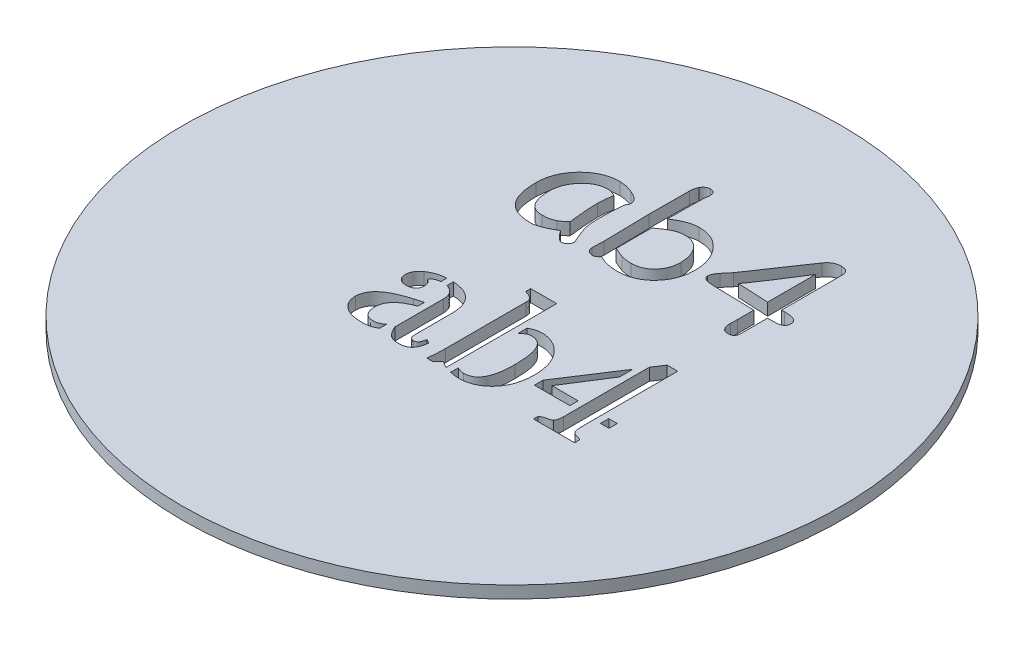
from build123d import *

# Parameters (mm, degrees)
SKETCH_2_R          = 18.845643173
EXTRUDE_2_DEPTH     = 0.7
SKETCH_1_W          = 0.487239366
SKETCH_1_H          = 0.472675146
CUT_EXTRUDE_1_DEPTH = 2.4


with BuildPart() as part:
    # Эскиз2 → Бобышка-Вытянуть2 (new body)
    with BuildSketch(Plane(origin=(0, 0, 0), x_dir=(1, 0, 0), z_dir=(0, 1, 0))):
        with Locations(Location((0, 0, 0), (0, 0, 270))):
            Circle(SKETCH_2_R)
    extrude(amount=EXTRUDE_2_DEPTH)

    # Эскиз1 → Вырез-Вытянуть1 (cut)
    # profile 1 of 11: a face of its own
    with BuildSketch(Plane(origin=(0, 0, 0), x_dir=(1, 0, 0), z_dir=(0, 1, 0))):
        with BuildLine():
            add(Edge.make_bspline(
                [(-2.260520196, 5.058187775), (-2.2769834, 5.061911652), (-2.317694537, 5.071120265), (-2.38128443, 5.115981547), (-2.462033272, 5.180543609), (-2.518968863, 5.235747272), (-2.550735039, 5.26654715)],
                knots=[0, 0, 0, 0, 0.555695463, 1.374155035, 2.534957635, 4, 4, 4, 4], degree=3))
            add(Edge.make_bspline(
                [(-2.550735039, 5.26654715), (-2.580452597, 5.297641936), (-2.63753641, 5.357371239), (-2.71309272, 5.447573671), (-2.779753485, 5.530558927), (-2.815371137, 5.587025085), (-2.832268243, 5.613812775)],
                knots=[0, 0, 0, 0, 1.151952229, 2.212760143, 3.152128841, 4, 4, 4, 4], degree=3))
            add(Edge.make_bspline(
                [(-2.832268243, 5.613812775), (-2.897392594, 5.576671649), (-3.022597015, 5.505266208), (-3.206172179, 5.407899619), (-3.378313795, 5.32595224), (-3.537984437, 5.258647147), (-3.685362526, 5.205873206), (-3.819663789, 5.16676142), (-3.942244109, 5.142668332), (-4.019910404, 5.139194129), (-4.056379571, 5.137562775)],
                knots=[0, 0, 0, 0, 1.357382431, 2.60962722, 3.761399541, 4.808177135, 5.745711274, 6.593953003, 7.339773276, 8, 8, 8, 8], degree=3))
            add(Edge.make_bspline(
                [(-4.056379571, 5.137562775), (-4.135834498, 5.139093758), (-4.289412381, 5.142052984), (-4.511442044, 5.168570092), (-4.71690321, 5.211009732), (-4.905406334, 5.272357285), (-5.078754949, 5.348637104), (-5.233911449, 5.44512655), (-5.374936563, 5.556536526), (-5.452528568, 5.645978969), (-5.491330743, 5.690707306)],
                knots=[0, 0, 0, 0, 1.198237041, 2.31606415, 3.368011987, 4.358092637, 5.301625415, 6.21724908, 7.108482723, 8, 8, 8, 8], degree=3))
            add(Edge.make_bspline(
                [(-5.491330743, 5.690707306), (-5.525473432, 5.736293186), (-5.59515498, 5.829329052), (-5.681925968, 5.986472474), (-5.754900475, 6.160836939), (-5.813541173, 6.352621419), (-5.861111625, 6.561018444), (-5.893562508, 6.786643726), (-5.913819922, 7.0297861), (-5.91573803, 7.197548974), (-5.916731133, 7.284408478)],
                knots=[0, 0, 0, 0, 0.812552431, 1.658331892, 2.555229492, 3.507519434, 4.518618694, 5.604829532, 6.759896565, 8, 8, 8, 8], degree=3))
            add(Edge.make_bspline(
                [(-5.916731133, 7.284408478), (-5.914555553, 7.367608581), (-5.910274223, 7.531338311), (-5.877309546, 7.772306463), (-5.822856007, 8.004186689), (-5.745639848, 8.226814289), (-5.64683069, 8.44013116), (-5.52760746, 8.644631929), (-5.384806451, 8.838941462), (-5.222605566, 9.021731492), (-5.045226105, 9.18921156), (-4.858255177, 9.337558907), (-4.661813035, 9.46290541), (-4.456937145, 9.565066529), (-4.242843142, 9.643273979), (-4.021658328, 9.700843941), (-3.791214553, 9.735113399), (-3.634815026, 9.739223708), (-3.555324883, 9.741312775)],
                knots=[0, 0, 0, 0, 1.054731984, 2.075610185, 3.077564362, 4.070606348, 5.058056501, 6.05423441, 7.067099876, 8.110607853, 9.148928189, 10.156761868, 11.132552149, 12.098435385, 13.053748134, 14.01750944, 14.992398115, 16, 16, 16, 16], degree=3))
            add(Edge.make_bspline(
                [(-3.555324883, 9.741312775), (-3.492767069, 9.738531688), (-3.362655322, 9.732747406), (-3.162601387, 9.696374588), (-2.951844983, 9.63628086), (-2.811148237, 9.580535036), (-2.73801043, 9.551556915)],
                knots=[0, 0, 0, 0, 0.889365109, 1.849758484, 2.882248842, 4, 4, 4, 4], degree=3))
            add(Edge.make_bspline(
                [(-2.73801043, 9.551556915), (-2.693036079, 9.531990423), (-2.607839021, 9.494924683), (-2.491356397, 9.431468635), (-2.392932382, 9.364987839), (-2.311843266, 9.295192884), (-2.248762418, 9.221641065), (-2.203174422, 9.145052257), (-2.173360661, 9.065038691), (-2.170279339, 9.009822587), (-2.168742852, 8.982289337)],
                knots=[0, 0, 0, 0, 1.381705711, 2.617431031, 3.732296057, 4.723070722, 5.624086893, 6.449303074, 7.226752293, 8, 8, 8, 8], degree=3))
            add(Edge.make_bspline(
                [(-2.168742852, 8.982289337), (-2.169519783, 8.963537197), (-2.171052809, 8.926535797), (-2.188792864, 8.87339803), (-2.214388652, 8.822515635), (-2.239956495, 8.793686831), (-2.253078789, 8.7788909)],
                knots=[0, 0, 0, 0, 0.993157303, 1.959680908, 2.952838212, 4, 4, 4, 4], degree=3))
            add(Edge.make_bspline(
                [(-2.253078789, 8.7788909), (-2.260226354, 8.747978757), (-2.276403127, 8.678016649), (-2.289760674, 8.558594543), (-2.307544634, 8.414202695), (-2.318501424, 8.243607426), (-2.328132305, 8.047208046), (-2.33745014, 7.825222109), (-2.341380834, 7.577111571), (-2.343659848, 7.403057175), (-2.344856133, 7.311693634)],
                knots=[0, 0, 0, 0, 0.516827984, 1.169714305, 1.956377237, 2.888851328, 3.955038626, 5.162311074, 6.510458132, 8, 8, 8, 8], degree=3))
            add(Edge.make_bspline(
                [(-2.344856133, 7.311693634), (-2.344444692, 7.228984378), (-2.343666411, 7.072531754), (-2.329998424, 6.851915847), (-2.308343632, 6.658049706), (-2.282503357, 6.539699031), (-2.270442071, 6.484457306)],
                knots=[0, 0, 0, 0, 1.19200198, 2.25478799, 3.185399486, 4, 4, 4, 4], degree=3))
            add(Edge.make_bspline(
                [(-2.270442071, 6.484457306), (-2.266037417, 6.467054616), (-2.256113236, 6.427844393), (-2.236033221, 6.363771154), (-2.209584819, 6.288386677), (-2.178886445, 6.201297545), (-2.141131588, 6.103096879), (-2.098087023, 5.992978082), (-2.047863656, 5.871433811), (-2.013253099, 5.786224265), (-1.995110039, 5.741556915)],
                knots=[0, 0, 0, 0, 0.543324072, 1.224170439, 2.031506418, 2.961691587, 4.019197454, 5.215989979, 6.540605439, 8, 8, 8, 8], degree=3))
            add(Edge.make_bspline(
                [(-1.995110039, 5.741556915), (-1.989379118, 5.727477369), (-1.976669194, 5.696252033), (-1.954127221, 5.644878129), (-1.925387631, 5.584999381), (-1.905335673, 5.541495579), (-1.894651055, 5.518314728)],
                knots=[0, 0, 0, 0, 0.745010443, 1.652269271, 2.749019729, 4, 4, 4, 4], degree=3))
            Line((-1.894651055, 5.518314728), (-1.868606133, 5.446381134))
            add(Edge.make_bspline(
                [(-1.868606133, 5.446381134), (-1.869877153, 5.419311434), (-1.872349258, 5.366661472), (-1.896367224, 5.291924253), (-1.931850588, 5.223024589), (-1.984780386, 5.1660371), (-2.045516976, 5.118577456), (-2.112546232, 5.083281401), (-2.185360376, 5.062867898), (-2.23517871, 5.059765762), (-2.260520196, 5.058187775)],
                knots=[0, 0, 0, 0, 1.055781092, 2.053470688, 3.044847395, 4.064324308, 5.067244292, 6.051071831, 7.008623294, 8, 8, 8, 8], degree=3))
        make_face()
        with BuildLine():
            add(Edge.make_bspline(
                [(-3.138606133, 8.01366629), (-3.137079223, 8.077352893), (-3.133892373, 8.210274694), (-3.117892834, 8.417411489), (-3.087056016, 8.638937336), (-3.060523936, 8.790958679), (-3.046828789, 8.869428009)],
                knots=[0, 0, 0, 0, 0.88697149, 1.851218968, 2.890857011, 4, 4, 4, 4], degree=3))
            add(Edge.make_bspline(
                [(-3.046828789, 8.869428009), (-3.094788833, 8.893929969), (-3.182303167, 8.938639534), (-3.306753349, 8.986659558), (-3.409085811, 9.018725024), (-3.471250717, 9.024449373), (-3.498274102, 9.026937775)],
                knots=[0, 0, 0, 0, 1.341238509, 2.447403828, 3.325078951, 4, 4, 4, 4], degree=3))
            add(Edge.make_bspline(
                [(-3.498274102, 9.026937775), (-3.552517448, 9.025181712), (-3.659920104, 9.021704683), (-3.81817738, 8.996625113), (-3.970180327, 8.953923918), (-4.117255423, 8.895687123), (-4.256965395, 8.817304912), (-4.39338599, 8.725748328), (-4.52270929, 8.615536189), (-4.64398566, 8.489852973), (-4.755073329, 8.353890526), (-4.854786096, 8.212244733), (-4.936019863, 8.063434336), (-5.005504674, 7.911021167), (-5.05689261, 7.752191637), (-5.096331373, 7.589045328), (-5.118626605, 7.420214134), (-5.121522834, 7.305967013), (-5.122981133, 7.248441681)],
                knots=[0, 0, 0, 0, 0.976615751, 1.933714126, 2.876548638, 3.815200477, 4.774727746, 5.755505532, 6.769702424, 7.827890142, 8.896423243, 9.928951538, 10.941972897, 11.945015674, 12.940821975, 13.942980332, 14.964256267, 16, 16, 16, 16], degree=3))
            add(Edge.make_bspline(
                [(-5.122981133, 7.248441681), (-5.122472015, 7.19218474), (-5.121482384, 7.082831669), (-5.107997337, 6.924419771), (-5.090771625, 6.77628437), (-5.063005484, 6.639673132), (-5.029240927, 6.51352803), (-4.984832545, 6.399229256), (-4.936287314, 6.29394598), (-4.877419979, 6.200646145), (-4.811598197, 6.117463388), (-4.736677434, 6.046866861), (-4.654815666, 5.986224371), (-4.565510255, 5.936196204), (-4.467025718, 5.899107951), (-4.361741994, 5.872471593), (-4.248854864, 5.853796331), (-4.170975167, 5.852570325), (-4.130793633, 5.851937775)],
                knots=[0, 0, 0, 0, 1.385053073, 2.692286587, 3.913500936, 5.055672189, 6.122813422, 7.125029461, 8.072314099, 8.973498475, 9.835345066, 10.677972226, 11.50067925, 12.339298428, 13.190189537, 14.084155314, 15.011532147, 16, 16, 16, 16], degree=3))
            add(Edge.make_bspline(
                [(-4.130793633, 5.851937775), (-4.064964358, 5.853935778), (-3.937673992, 5.857799206), (-3.754368025, 5.884741756), (-3.586061419, 5.931124967), (-3.483705531, 5.977934678), (-3.433781914, 6.0007659)],
                knots=[0, 0, 0, 0, 1.098427608, 2.12396769, 3.084973818, 4, 4, 4, 4], degree=3))
            add(Edge.make_bspline(
                [(-3.433781914, 6.0007659), (-3.405423027, 6.017327674), (-3.341690387, 6.054547949), (-3.24221643, 6.126014603), (-3.127528572, 6.217482365), (-3.047783865, 6.286918519), (-3.004660821, 6.324467071)],
                knots=[0, 0, 0, 0, 0.731520458, 1.643990121, 2.725955338, 4, 4, 4, 4], degree=3))
            add(Edge.make_bspline(
                [(-3.004660821, 6.324467071), (-3.015136149, 6.415402192), (-3.035412891, 6.591422255), (-3.062534885, 6.846932566), (-3.086646712, 7.084567464), (-3.104844893, 7.304587239), (-3.120446655, 7.506689739), (-3.129995221, 7.691557663), (-3.136697687, 7.858589784), (-3.137995551, 7.964051573), (-3.138606133, 8.01366629)],
                knots=[0, 0, 0, 0, 1.29584854, 2.508330538, 3.637509546, 4.677124825, 5.633672839, 6.506959432, 7.297595963, 8, 8, 8, 8], degree=3))
        make_face(mode=Mode.SUBTRACT)
    # profile 2 of 11: a face of its own
    with BuildSketch(Plane(origin=(0, 0, 0), x_dir=(1, 0, 0), z_dir=(0, 1, 0))):
        with BuildLine():
            add(Edge.make_bspline(
                [(0.799138007, 5.216937775), (0.745788762, 5.218094442), (0.640192209, 5.220383887), (0.483137404, 5.232502515), (0.329896627, 5.254814063), (0.180641081, 5.286410045), (0.034765936, 5.32402418), (-0.106872526, 5.373423513), (-0.245766484, 5.429374785), (-0.334740446, 5.474660538), (-0.379084649, 5.497230743)],
                knots=[0, 0, 0, 0, 1.04690103, 2.072178137, 3.08856036, 4.082853573, 5.064660397, 6.042000395, 7.02414225, 8, 8, 8, 8], degree=3))
            add(Edge.make_bspline(
                [(-0.379084649, 5.497230743), (-0.401702198, 5.466576155), (-0.444356024, 5.408765495), (-0.526535544, 5.345637172), (-0.614939176, 5.302653836), (-0.678324264, 5.298435797), (-0.710227227, 5.296312775)],
                knots=[0, 0, 0, 0, 1.127682817, 2.126666575, 3.057114412, 4, 4, 4, 4], degree=3))
            add(Edge.make_bspline(
                [(-0.710227227, 5.296312775), (-0.736398287, 5.29783683), (-0.787052314, 5.300786635), (-0.860383432, 5.321188606), (-0.926792058, 5.356761019), (-0.985796275, 5.40471261), (-1.034654027, 5.463114649), (-1.069967938, 5.530301483), (-1.09166733, 5.604642696), (-1.094494259, 5.656660788), (-1.095940118, 5.6832659)],
                knots=[0, 0, 0, 0, 1.031178717, 1.995844095, 2.972544323, 3.980284098, 4.975430773, 5.952131002, 6.952599355, 8, 8, 8, 8], degree=3))
            add(Edge.make_bspline(
                [(-1.095940118, 5.6832659), (-1.095474598, 5.703521648), (-1.094448592, 5.748165396), (-1.094011459, 5.821387303), (-1.089083342, 5.907310312), (-1.08648895, 6.002044808), (-1.081172409, 6.097073637), (-1.076913016, 6.18345753), (-1.076324216, 6.257086093), (-1.075314336, 6.301730538), (-1.074856133, 6.321986603)],
                knots=[0, 0, 0, 0, 0.760846403, 1.676908415, 2.749093299, 3.991905837, 5.2353969, 6.323091585, 7.239153597, 8, 8, 8, 8], degree=3))
            add(Edge.make_bspline(
                [(-1.074856133, 6.321986603), (-1.074783469, 6.360847454), (-1.074628861, 6.443532066), (-1.075943917, 6.574176016), (-1.078735046, 6.718445651), (-1.081305483, 6.876366845), (-1.082952053, 7.047966295), (-1.088921514, 7.233548986), (-1.093548064, 7.432407501), (-1.098445492, 7.640768565), (-1.10324356, 7.848718606), (-1.107968893, 8.047988061), (-1.113868891, 8.233572581), (-1.115539515, 8.405584778), (-1.118105233, 8.563506093), (-1.120897464, 8.7077757), (-1.122212268, 8.838419657), (-1.12205769, 8.921104268), (-1.121985039, 8.959965118)],
                knots=[0, 0, 0, 0, 0.706964872, 1.504216054, 2.376770452, 3.332043551, 4.377557263, 5.498575529, 6.709814547, 7.996240749, 9.290185809, 10.493906259, 11.622442737, 12.667956449, 13.623229548, 14.495783946, 15.293035128, 16, 16, 16, 16], degree=3))
            add(Edge.make_bspline(
                [(-1.121985039, 8.959965118), (-1.121990167, 8.988077121), (-1.122001479, 9.050088891), (-1.121897689, 9.151374227), (-1.122392701, 9.269614047), (-1.120124517, 9.404791195), (-1.121331531, 9.556935081), (-1.118863381, 9.726012672), (-1.120018983, 9.911641275), (-1.118055206, 10.108834817), (-1.117294992, 10.306033984), (-1.11527189, 10.492064736), (-1.11642486, 10.661570945), (-1.113962585, 10.814111308), (-1.115163074, 10.950133149), (-1.112907867, 11.068772777), (-1.113378762, 11.170889986), (-1.113327035, 11.233314849), (-1.113303399, 11.261840118)],
                knots=[0, 0, 0, 0, 0.586198384, 1.29308467, 2.112038294, 3.051719364, 4.112048793, 5.284477253, 6.577561923, 7.982740374, 9.396539228, 10.689652632, 11.8620494, 12.931034153, 13.87067568, 14.698294766, 15.405181052, 16, 16, 16, 16], degree=3))
            add(Edge.make_bspline(
                [(-1.113303399, 11.261840118), (-1.112452074, 11.3024839), (-1.11078054, 11.382285969), (-1.087556008, 11.497884364), (-1.057306318, 11.609026826), (-1.023501676, 11.676937695), (-1.006643243, 11.710804962)],
                knots=[0, 0, 0, 0, 1.044703072, 2.051223175, 3.028141653, 4, 4, 4, 4], degree=3))
            add(Edge.make_bspline(
                [(-1.006643243, 11.710804962), (-0.982880585, 11.749109396), (-0.937684067, 11.821964337), (-0.843232171, 11.903404516), (-0.734858201, 11.955292487), (-0.657063154, 11.960926523), (-0.617209649, 11.963812775)],
                knots=[0, 0, 0, 0, 1.102656239, 2.097249514, 3.025242864, 4, 4, 4, 4], degree=3))
            add(Edge.make_bspline(
                [(-0.617209649, 11.963812775), (-0.592309314, 11.962621117), (-0.544737835, 11.960344485), (-0.478132387, 11.943362413), (-0.421540274, 11.913781737), (-0.373832883, 11.87360757), (-0.339033287, 11.819290273), (-0.314342629, 11.754730776), (-0.299538404, 11.67880017), (-0.298033033, 11.624473218), (-0.29722918, 11.595463165)],
                knots=[0, 0, 0, 0, 1.069996723, 2.044202454, 2.926544356, 3.795904631, 4.692978392, 5.666535517, 6.753953128, 8, 8, 8, 8], degree=3))
            add(Edge.make_bspline(
                [(-0.29722918, 11.595463165), (-0.298417773, 11.571018918), (-0.301255259, 11.512663999), (-0.318313164, 11.421830353), (-0.33537107, 11.330996706), (-0.338208556, 11.272641788), (-0.339397149, 11.24819754)],
                knots=[0, 0, 0, 0, 0.837778476, 2, 3.162221524, 4, 4, 4, 4], degree=3))
            Line((-0.339397149, 11.24819754), (-0.351799493, 10.321742462))
            Line((-0.351799493, 10.321742462), (-0.360481133, 9.247699493))
            add(Edge.make_bspline(
                [(-0.360481133, 9.247699493), (-0.300081814, 9.286747146), (-0.182616917, 9.362687215), (-0.005267208, 9.463434882), (0.167574731, 9.548074462), (0.335554638, 9.618171914), (0.499076974, 9.673460978), (0.658512668, 9.711658092), (0.812788949, 9.737095387), (0.914386221, 9.739927339), (0.964089179, 9.741312775)],
                knots=[0, 0, 0, 0, 1.204180757, 2.341896757, 3.41311755, 4.424888868, 5.388106114, 6.299820328, 7.168245785, 8, 8, 8, 8], degree=3))
            add(Edge.make_bspline(
                [(0.964089179, 9.741312775), (1.038196633, 9.739049392), (1.183352693, 9.73461605), (1.395996772, 9.703284127), (1.598080017, 9.650314493), (1.788577742, 9.573645287), (1.969352719, 9.477741687), (2.138263898, 9.358882399), (2.297445033, 9.219309411), (2.391896713, 9.112370439), (2.439968086, 9.057943634)],
                knots=[0, 0, 0, 0, 1.056289991, 2.068980708, 3.056807806, 4.027556406, 4.98994988, 5.967668714, 6.965640913, 8, 8, 8, 8], degree=3))
            add(Edge.make_bspline(
                [(2.439968086, 9.057943634), (2.482897108, 9.003797534), (2.568415176, 8.895934143), (2.675531351, 8.719490095), (2.767876081, 8.535418442), (2.844151272, 8.342208035), (2.902334749, 8.13947672), (2.942823846, 7.927321519), (2.968226296, 7.70629098), (2.971569615, 7.555675856), (2.973268867, 7.479125275)],
                knots=[0, 0, 0, 0, 0.973927232, 1.940141456, 2.905122926, 3.876532643, 4.865843001, 5.875754331, 6.920345875, 8, 8, 8, 8], degree=3))
            add(Edge.make_bspline(
                [(2.973268867, 7.479125275), (2.971269969, 7.401740259), (2.967333126, 7.249329987), (2.93899115, 7.025235954), (2.888684523, 6.810787963), (2.820253118, 6.605269463), (2.733562869, 6.407637322), (2.624408035, 6.220316115), (2.497907981, 6.040617255), (2.351997446, 5.873693244), (2.193283229, 5.720149774), (2.022507256, 5.585543363), (1.842684172, 5.470602706), (1.651842693, 5.378046582), (1.45206382, 5.306553056), (1.242898992, 5.253715719), (1.024172843, 5.222216896), (0.874895175, 5.218714972), (0.799138007, 5.216937775)],
                knots=[0, 0, 0, 0, 1.061516785, 2.090663926, 3.092171209, 4.078566274, 5.058647769, 6.046997383, 7.047797864, 8.068960007, 9.083755475, 10.073129682, 11.047038334, 12.0058191, 12.976353236, 13.952966279, 14.961147523, 16, 16, 16, 16], degree=3))
        make_face()
        with BuildLine():
            add(Edge.make_bspline(
                [(0.949206367, 8.947562775), (0.89158736, 8.944875087), (0.77412702, 8.939396049), (0.597255395, 8.903400124), (0.418277818, 8.843415046), (0.302869126, 8.78688237), (0.243513007, 8.757806915)],
                knots=[0, 0, 0, 0, 0.937395904, 1.91094653, 2.925573941, 4, 4, 4, 4], degree=3))
            add(Edge.make_bspline(
                [(0.243513007, 8.757806915), (0.227348519, 8.748785386), (0.192239374, 8.729190693), (0.136154109, 8.695666821), (0.073187072, 8.654038739), (0.001020532, 8.607467749), (-0.078252693, 8.552697935), (-0.164849022, 8.490206613), (-0.260284268, 8.422481568), (-0.32621332, 8.374637581), (-0.360481133, 8.349769806)],
                knots=[0, 0, 0, 0, 0.609139885, 1.323047175, 2.1494143, 3.092697454, 4.149248574, 5.319490649, 6.606756931, 8, 8, 8, 8], degree=3))
            Line((-0.360481133, 8.349769806), (-0.369162774, 7.637875275))
            Line((-0.369162774, 7.637875275), (-0.365442071, 6.995433868))
            Line((-0.365442071, 6.995433868), (-0.360481133, 6.319506134))
            add(Edge.make_bspline(
                [(-0.360481133, 6.319506134), (-0.323751814, 6.303233518), (-0.243640778, 6.267740997), (-0.111992476, 6.213544044), (0.04024612, 6.153011153), (0.148803579, 6.11104946), (0.206305976, 6.08882254)],
                knots=[0, 0, 0, 0, 0.787660738, 1.717982245, 2.791225477, 4, 4, 4, 4], degree=3))
            add(Edge.make_bspline(
                [(0.206305976, 6.08882254), (0.250752707, 6.076335147), (0.341633409, 6.050802043), (0.484832092, 6.029192953), (0.635063347, 6.013204546), (0.737904669, 6.011538911), (0.790456367, 6.010687775)],
                knots=[0, 0, 0, 0, 0.936022172, 1.913894488, 2.934004501, 4, 4, 4, 4], degree=3))
            add(Edge.make_bspline(
                [(0.790456367, 6.010687775), (0.840135581, 6.011728345), (0.9374313, 6.013766279), (1.079988519, 6.034227722), (1.21542476, 6.067580976), (1.344127555, 6.113985777), (1.467080064, 6.17213749), (1.58211504, 6.24595708), (1.69069444, 6.331855812), (1.79060239, 6.430085852), (1.882344861, 6.537021462), (1.961277315, 6.652654005), (2.02955604, 6.773868655), (2.083436475, 6.90237381), (2.127908923, 7.036429551), (2.156666354, 7.178036825), (2.176166728, 7.325205591), (2.178391844, 7.425729413), (2.179518867, 7.476644806)],
                knots=[0, 0, 0, 0, 1.054588762, 2.065390412, 3.051403709, 4.012390421, 4.966735262, 5.93380018, 6.908805009, 7.902296473, 8.905172546, 9.896449817, 10.871256936, 11.854725678, 12.851587217, 13.865929471, 14.919091655, 16, 16, 16, 16], degree=3))
            add(Edge.make_bspline(
                [(2.179518867, 7.476644806), (2.17859339, 7.526703182), (2.176776431, 7.624981164), (2.16168178, 7.769287645), (2.136565712, 7.907155837), (2.103844585, 8.039508341), (2.058736655, 8.16509358), (2.004073605, 8.283970024), (1.940784076, 8.39758335), (1.890042571, 8.467248999), (1.864499336, 8.502318634)],
                knots=[0, 0, 0, 0, 1.099361938, 2.15834157, 3.182527438, 4.175813873, 5.1494808, 6.108427642, 7.047783904, 8, 8, 8, 8], degree=3))
            add(Edge.make_bspline(
                [(1.864499336, 8.502318634), (1.83600787, 8.537833024), (1.779842154, 8.607843152), (1.682009593, 8.697732227), (1.578992533, 8.776165577), (1.466656484, 8.838361288), (1.347932533, 8.888290438), (1.221246372, 8.923231106), (1.087488846, 8.942859193), (0.995985313, 8.945971621), (0.949206367, 8.947562775)],
                knots=[0, 0, 0, 0, 1.031936804, 2.034274746, 3.006293907, 3.964080954, 4.939851267, 5.923215237, 6.938294535, 8, 8, 8, 8], degree=3))
        make_face(mode=Mode.SUBTRACT)
    # profile 3 of 11: a face of its own
    with BuildSketch(Plane(origin=(0, 0, 0), x_dir=(1, 0, 0), z_dir=(0, 1, 0))):
        with BuildLine():
            Line((7.418268867, 7.201312775), (7.418268867, 5.679545196))
            add(Edge.make_bspline(
                [(7.418268867, 5.679545196), (7.417122317, 5.649684691), (7.414950532, 5.593123188), (7.397765354, 5.514110985), (7.369270087, 5.445978219), (7.327555288, 5.390161189), (7.273598507, 5.346333388), (7.207327756, 5.31679407), (7.130156383, 5.299653798), (7.075231495, 5.297468113), (7.046198554, 5.296312775)],
                knots=[0, 0, 0, 0, 1.169846186, 2.215912189, 3.152384091, 4.043869571, 4.919746346, 5.848046681, 6.862491365, 8, 8, 8, 8], degree=3))
            add(Edge.make_bspline(
                [(7.046198554, 5.296312775), (7.01204171, 5.297525064), (6.946909618, 5.299836723), (6.856585409, 5.329769524), (6.779045757, 5.37636045), (6.717019985, 5.44397391), (6.667823192, 5.528815778), (6.636150066, 5.632709543), (6.614144629, 5.7534447), (6.612823276, 5.840240074), (6.612116523, 5.886664337)],
                knots=[0, 0, 0, 0, 0.979258328, 1.867302019, 2.706068824, 3.55623654, 4.478688954, 5.505929839, 6.665996101, 8, 8, 8, 8], degree=3))
            add(Edge.make_bspline(
                [(6.612116523, 5.886664337), (6.612909307, 5.91601683), (6.614774527, 5.985075888), (6.61793353, 6.074828642), (6.623518479, 6.152454792), (6.625021443, 6.203784977), (6.628745399, 6.244222876), (6.6283912, 6.267411326), (6.62823957, 6.277338165)],
                knots=[0, 0, 0, 0, 1.351581217, 3.17993174, 4.133083147, 4.933198664, 5.543308631, 6, 6, 6, 6], degree=3))
            Line((6.62823957, 6.277338165), (6.624518867, 7.201312775))
            Line((6.624518867, 7.201312775), (4.78277082, 7.244720978))
            add(Edge.make_bspline(
                [(4.78277082, 7.244720978), (4.736879511, 7.244464509), (4.648809705, 7.243972322), (4.521910187, 7.247347264), (4.40612865, 7.249192893), (4.30111319, 7.253035381), (4.207647422, 7.257724932), (4.124953003, 7.264015952), (4.053331271, 7.27096417), (4.009256767, 7.277628142), (3.98902082, 7.280687775)],
                knots=[0, 0, 0, 0, 1.384912504, 2.657779423, 3.830853642, 4.879563718, 5.829104526, 6.654925644, 7.382435391, 8, 8, 8, 8], degree=3))
            add(Edge.make_bspline(
                [(3.98902082, 7.280687775), (3.959131618, 7.286338863), (3.902888885, 7.296972559), (3.82486593, 7.320376496), (3.758774104, 7.349731524), (3.704245862, 7.384786866), (3.660891733, 7.424506149), (3.629657592, 7.470595628), (3.611943379, 7.522955993), (3.609511568, 7.559612075), (3.608268867, 7.578344025)],
                knots=[0, 0, 0, 0, 1.379706499, 2.596203994, 3.68766332, 4.650280589, 5.526184501, 6.337857579, 7.1506139, 8, 8, 8, 8], degree=3))
            add(Edge.make_bspline(
                [(3.608268867, 7.578344025), (3.611791482, 7.612156637), (3.619493198, 7.686083281), (3.666387757, 7.800716438), (3.738958938, 7.926687406), (3.802347556, 8.010639658), (3.836471992, 8.055834259)],
                knots=[0, 0, 0, 0, 0.756102799, 1.65311517, 2.736585152, 4, 4, 4, 4], degree=3))
            Line((3.836471992, 8.055834259), (4.194899726, 8.483715118))
            Line((4.194899726, 8.483715118), (6.241286445, 11.495004181))
            add(Edge.make_bspline(
                [(6.241286445, 11.495004181), (6.264531369, 11.526209607), (6.309629285, 11.586751845), (6.387955713, 11.665439209), (6.46997417, 11.732516075), (6.555581051, 11.789599893), (6.647357277, 11.832024067), (6.743811739, 11.861523788), (6.844500839, 11.881042398), (6.913402647, 11.883297984), (6.948220039, 11.884437775)],
                knots=[0, 0, 0, 0, 1.10976452, 2.153075109, 3.1596165, 4.1319419, 5.082458473, 6.034439633, 7.006765033, 8, 8, 8, 8], degree=3))
            add(Edge.make_bspline(
                [(6.948220039, 11.884437775), (6.985126538, 11.883543377), (7.05459409, 11.881859889), (7.151346126, 11.86180971), (7.234003833, 11.830127856), (7.301729674, 11.784245242), (7.356253317, 11.726122518), (7.391673101, 11.652485045), (7.414889525, 11.567521762), (7.417098253, 11.506344034), (7.418268867, 11.473920196)],
                knots=[0, 0, 0, 0, 1.238680683, 2.33151654, 3.304325217, 4.194636066, 5.060203577, 5.948886303, 6.912921778, 8, 8, 8, 8], degree=3))
            Line((7.418268867, 11.473920196), (7.418268867, 7.995062775))
            add(Edge.make_bspline(
                [(7.418268867, 7.995062775), (7.444724771, 7.995999004), (7.502584451, 7.998046558), (7.560478986, 7.998524222), (7.591901679, 7.998783478)],
                knots=[0, 0, 0, 0, 0.914484986, 2, 2, 2, 2], degree=3))
            add(Edge.make_bspline(
                [(7.591901679, 7.998783478), (7.652712417, 7.997697381), (7.766805534, 7.995659648), (7.926244395, 7.978272269), (8.061172058, 7.946342618), (8.173410593, 7.904125519), (8.261723656, 7.846909947), (8.326204566, 7.775105436), (8.363885888, 7.688270972), (8.368437556, 7.626239077), (8.370768867, 7.594467071)],
                knots=[0, 0, 0, 0, 1.491825352, 2.798962969, 3.925660001, 4.886213554, 5.727316361, 6.482038053, 7.222517784, 8, 8, 8, 8], degree=3))
            add(Edge.make_bspline(
                [(8.370768867, 7.594467071), (8.369935795, 7.570803552), (8.368338865, 7.525442571), (8.352822441, 7.460901075), (8.328517825, 7.402455385), (8.291066856, 7.352586101), (8.245647171, 7.307733688), (8.189303278, 7.271208739), (8.123491128, 7.240427848), (8.075041452, 7.227800692), (8.049548164, 7.221156525)],
                knots=[0, 0, 0, 0, 1.052635893, 2.017814653, 2.941857055, 3.852022768, 4.77698288, 5.773304414, 6.828355536, 8, 8, 8, 8], degree=3))
            add(Edge.make_bspline(
                [(8.049548164, 7.221156525), (8.035951654, 7.217994769), (8.005307615, 7.210868751), (7.952870614, 7.205776886), (7.890042475, 7.200802855), (7.816428709, 7.196879797), (7.732048727, 7.196220321), (7.63696276, 7.196215935), (7.531101185, 7.197160822), (7.457124875, 7.199882969), (7.418268867, 7.201312775)],
                knots=[0, 0, 0, 0, 0.528828037, 1.191881445, 1.993827588, 2.919923687, 3.986026796, 5.193101272, 6.525678293, 8, 8, 8, 8], degree=3))
        make_face()
        with BuildLine():
            add(Edge.make_bspline(
                [(6.624518867, 10.733500275), (6.53415825, 10.589934693), (6.359129345, 10.311847543), (6.102051501, 9.909812014), (5.860514283, 9.535737645), (5.634662927, 9.189105659), (5.424129838, 8.870838249), (5.229155877, 8.580097783), (5.050048584, 8.317053019), (4.933479182, 8.152414758), (4.878268867, 8.074437775)],
                knots=[0, 0, 0, 0, 1.279636809, 2.478662012, 3.599736217, 4.638573139, 5.599520427, 6.478296641, 7.279281522, 8, 8, 8, 8], degree=3))
            Line((4.878268867, 8.074437775), (6.624518867, 7.995062775))
            Line((6.624518867, 7.995062775), (6.624518867, 10.733500275))
        make_face(mode=Mode.SUBTRACT)
    # profile 4 of 11: a face of its own
    with BuildSketch(Plane(origin=(0, 0, 0), x_dir=(1, 0, 0), z_dir=(0, 1, 0))):
        with BuildLine():
            add(Edge.make_bspline(
                [(-3.175664812, -2.210766758), (-3.224381925, -2.228871882), (-3.319060607, -2.264058067), (-3.45514282, -2.322847172), (-3.58158152, -2.384567431), (-3.699018817, -2.449489187), (-3.806243672, -2.518400903), (-3.904590295, -2.590321841), (-3.994745513, -2.663673033), (-4.075053008, -2.741060384), (-4.145182987, -2.821938905), (-4.206780964, -2.905783661), (-4.258740869, -2.992939076), (-4.299468006, -3.084016951), (-4.333304291, -3.177136734), (-4.357282126, -3.273812621), (-4.370212689, -3.373790781), (-4.372665142, -3.441189061), (-4.373902927, -3.475205873)],
                knots=[0, 0, 0, 0, 1.337694828, 2.599726788, 3.814068401, 4.958365505, 6.051907549, 7.092655371, 8.09344693, 9.041520751, 9.959577153, 10.84580025, 11.716745026, 12.565777618, 13.410237291, 14.26442293, 15.124031069, 16, 16, 16, 16], degree=3))
            add(Edge.make_bspline(
                [(-4.373902927, -3.475205873), (-4.371803932, -3.528294475), (-4.367781316, -3.63003606), (-4.339114889, -3.775314642), (-4.288564277, -3.904165437), (-4.218348542, -4.015972131), (-4.126768421, -4.107748972), (-4.012327655, -4.172374198), (-3.878334568, -4.208535742), (-3.731361764, -4.220988501), (-3.578459979, -4.208014624), (-3.431184105, -4.161083279), (-3.293110525, -4.086863064), (-3.215360414, -4.015892023), (-3.175664812, -3.9796575)],
                knots=[0, 0, 0, 0, 1.102333847, 2.112566327, 3.05890707, 3.961537614, 4.836520626, 5.723282189, 6.657471527, 7.697251232, 8.774375412, 9.820920078, 10.887462829, 12, 12, 12, 12], degree=3))
            Line((-3.175664812, -3.9796575), (-3.175664812, -4.404667925))
            add(Edge.make_bspline(
                [(-3.175664812, -4.404667925), (-3.233947901, -4.436581061), (-3.350736926, -4.500529354), (-3.542749231, -4.562521395), (-3.744610756, -4.601799815), (-3.951913418, -4.612795262), (-4.153085992, -4.60654406), (-4.3380419, -4.591743487), (-4.50209321, -4.566012108), (-4.646030019, -4.528566877), (-4.773503282, -4.481774959), (-4.888590151, -4.426313572), (-4.99501717, -4.365777051), (-5.058073105, -4.316295997), (-5.088873736, -4.292126224)],
                knots=[0, 0, 0, 0, 1.183306686, 2.371137762, 3.581951824, 4.844366142, 6.065354755, 7.171858583, 8.15317055, 9.024137825, 9.821392881, 10.571643768, 11.302297662, 12, 12, 12, 12], degree=3))
            add(Edge.make_bspline(
                [(-5.088873736, -4.292126224), (-5.118711032, -4.266815038), (-5.176958023, -4.217403708), (-5.251419735, -4.13167083), (-5.31713048, -4.042738673), (-5.368677025, -3.945527459), (-5.411027955, -3.843493152), (-5.436991264, -3.733854678), (-5.45758037, -3.619846462), (-5.458918906, -3.541508667), (-5.459599341, -3.501686274)],
                knots=[0, 0, 0, 0, 1.036324833, 2.023065489, 3.00423523, 3.962797592, 4.93449399, 5.92539228, 6.945389719, 8, 8, 8, 8], degree=3))
            add(Edge.make_bspline(
                [(-5.459599341, -3.501686274), (-5.458408378, -3.460118404), (-5.456035964, -3.377314713), (-5.434471592, -3.255317145), (-5.397673008, -3.137593788), (-5.349378288, -3.023163556), (-5.28407923, -2.914062134), (-5.207389795, -2.80741701), (-5.115112263, -2.705349481), (-5.009156377, -2.607483159), (-4.888433698, -2.514637455), (-4.754739822, -2.424330756), (-4.605758681, -2.339213673), (-4.444400557, -2.254930911), (-4.26783942, -2.177677263), (-4.077687852, -2.103726402), (-3.874166603, -2.031409736), (-3.731978528, -1.989831249), (-3.658932118, -1.968471094)],
                knots=[0, 0, 0, 0, 0.785817842, 1.565358479, 2.333779293, 3.115328771, 3.908517058, 4.733403949, 5.596520351, 6.506256834, 7.458071064, 8.474501984, 9.555522906, 10.701750213, 11.916371662, 13.198402457, 14.560732732, 16, 16, 16, 16], degree=3))
            add(Edge.make_bspline(
                [(-3.658932118, -1.968471094), (-3.576536593, -1.944150054), (-3.416207423, -1.896825004), (-3.254344158, -1.855050865), (-3.175664812, -1.834745073)],
                knots=[0, 0, 0, 0, 1.0278295, 2, 2, 2, 2], degree=3))
            Line((-3.175664812, -1.834745073), (-3.175664812, -2.210766758))
        make_face()
    # profile 5 of 11: a face of its own
    with BuildSketch(Plane(origin=(0, 0, 0), x_dir=(1, 0, 0), z_dir=(0, 1, 0))):
        with BuildLine():
            add(Edge.make_bspline(
                [(-4.234880825, -0.610026557), (-4.215624036, -0.618753488), (-4.17783901, -0.635877179), (-4.126621662, -0.670517731), (-4.0840386, -0.713565582), (-4.048335294, -0.76376238), (-4.022447609, -0.82247075), (-4.004186809, -0.888525013), (-3.991918846, -0.961326293), (-3.99061401, -1.012475325), (-3.989937122, -1.039009043)],
                knots=[0, 0, 0, 0, 0.958340741, 1.880424008, 2.786714005, 3.692339972, 4.660258113, 5.680817273, 6.79691683, 8, 8, 8, 8], degree=3))
            add(Edge.make_bspline(
                [(-3.989937122, -1.039009043), (-3.99143776, -1.073234916), (-3.994344025, -1.139519743), (-4.024958267, -1.233136367), (-4.073574257, -1.316032459), (-4.140956575, -1.386458944), (-4.223434315, -1.444188466), (-4.321453559, -1.483337048), (-4.43119792, -1.508887062), (-4.550114859, -1.515694239), (-4.668530023, -1.506853042), (-4.779285175, -1.483440635), (-4.875207794, -1.437801928), (-4.958514132, -1.379022595), (-5.023644936, -1.303303078), (-5.072740539, -1.217743643), (-5.100640528, -1.12067379), (-5.108666799, -1.016973293), (-5.101534186, -0.912057365), (-5.083500512, -0.80995608), (-5.051374249, -0.71361959), (-5.00574425, -0.623090407), (-4.948350378, -0.538034456), (-4.879781658, -0.458360338), (-4.802295778, -0.38215427), (-4.742995384, -0.338356974), (-4.712852052, -0.316094114)],
                knots=[0, 0, 0, 0, 0.982413316, 1.902627729, 2.80261908, 3.728430743, 4.687139903, 5.678224868, 6.747738224, 7.919193595, 9.091544442, 10.161057798, 11.155882413, 12.129298097, 13.074780711, 14.007801298, 14.948576369, 15.956300383, 16.987462971, 17.969383149, 18.933717255, 19.899724101, 20.879422085, 21.879991333, 22.922365926, 24, 24, 24, 24], degree=3))
            add(Edge.make_bspline(
                [(-4.712852052, -0.316094114), (-4.645248133, -0.271865798), (-4.507462182, -0.181722494), (-4.271155506, -0.086973211), (-4.011886845, -0.017986925), (-3.828841472, 0.001094159), (-3.734401259, 0.01093883)],
                knots=[0, 0, 0, 0, 0.926384955, 1.888098141, 2.910387865, 4, 4, 4, 4], degree=3))
            Line((-3.734401259, 0.01093883), (-3.734401259, -0.329334314))
            add(Edge.make_bspline(
                [(-3.734401259, -0.329334314), (-3.790606859, -0.33704971), (-3.896603158, -0.351599922), (-4.039541193, -0.409755411), (-4.157395318, -0.494258648), (-4.209118111, -0.571535545), (-4.234880825, -0.610026557)],
                knots=[0, 0, 0, 0, 1.136618956, 2.143512439, 3.075298215, 4, 4, 4, 4], degree=3))
        make_face()
    # profile 6 of 11: a face of its own
    with BuildSketch(Plane(origin=(0, 0, 0), x_dir=(1, 0, 0), z_dir=(0, 1, 0))):
        with BuildLine():
            add(Edge.make_bspline(
                [(-1.576248632, -4.047182521), (-1.556622649, -4.046074486), (-1.517903338, -4.043888488), (-1.462902781, -4.021140136), (-1.414629381, -3.983995096), (-1.371753764, -3.934025046), (-1.336068564, -3.869862083), (-1.306063534, -3.79224913), (-1.281248776, -3.700768154), (-1.269824448, -3.63464768), (-1.263779908, -3.599663755)],
                knots=[0, 0, 0, 0, 0.787502194, 1.553631299, 2.353880942, 3.223810975, 4.187726269, 5.297297473, 6.570017161, 8, 8, 8, 8], degree=3))
            Line((-1.263779908, -3.599663755), (-1.036048465, -3.720149577))
            add(Edge.make_bspline(
                [(-1.036048465, -3.720149577), (-1.045009467, -3.788396416), (-1.062033828, -3.918053674), (-1.111553709, -4.098821353), (-1.182410727, -4.253111548), (-1.255935181, -4.363770447), (-1.326470576, -4.436860891), (-1.386626311, -4.482888169), (-1.453216417, -4.523538755), (-1.52810308, -4.554515195), (-1.609036784, -4.580189019), (-1.697514754, -4.596784457), (-1.793121035, -4.607569955), (-1.859556487, -4.609098331), (-1.894013436, -4.609891028)],
                knots=[0, 0, 0, 0, 1.77617115, 3.374419687, 4.817445551, 6.14506957, 6.781718568, 7.431391624, 8.095888027, 8.790204004, 9.518301732, 10.284890527, 11.110453276, 12, 12, 12, 12], degree=3))
            add(Edge.make_bspline(
                [(-1.894013436, -4.609891028), (-1.945770525, -4.608510628), (-2.042775825, -4.605923426), (-2.177119564, -4.583547118), (-2.292593159, -4.54860516), (-2.35544152, -4.508439429), (-2.385224862, -4.489405206)],
                knots=[0, 0, 0, 0, 1.208162604, 2.264388854, 3.177507569, 4, 4, 4, 4], degree=3))
            add(Edge.make_bspline(
                [(-2.385224862, -4.489405206), (-2.427558548, -4.453611163), (-2.514789919, -4.37985516), (-2.624638951, -4.240174878), (-2.726117972, -4.078943527), (-2.777916935, -3.958008902), (-2.804939207, -3.894920219)],
                knots=[0, 0, 0, 0, 0.90182454, 1.858269316, 2.882710661, 4, 4, 4, 4], degree=3))
            Line((-2.804939207, -3.894920219), (-2.804939207, -1.110506124))
            add(Edge.make_bspline(
                [(-2.804939207, -1.110506124), (-2.806772295, -1.065813331), (-2.810345437, -0.978695961), (-2.836741338, -0.852156583), (-2.884162904, -0.735926154), (-2.947794441, -0.629102956), (-3.028266466, -0.534718614), (-3.125902527, -0.45670656), (-3.23817336, -0.394497208), (-3.321165545, -0.36891724), (-3.363675655, -0.355814714)],
                knots=[0, 0, 0, 0, 1.056232939, 2.058860726, 3.037203418, 4.010526933, 4.987087983, 5.951649723, 6.950797663, 8, 8, 8, 8], degree=3))
            Line((-3.363675655, -0.355814714), (-3.363675655, 0.01093883))
            add(Edge.make_bspline(
                [(-3.363675655, 0.01093883), (-3.302245209, 0.006490758), (-3.183336454, -0.002119221), (-3.011023895, -0.028619846), (-2.850837844, -0.067058617), (-2.701848985, -0.115225548), (-2.565214416, -0.176759664), (-2.441085076, -0.249882471), (-2.326356939, -0.33191615), (-2.225913778, -0.428155103), (-2.136573843, -0.534650341), (-2.058900152, -0.652214628), (-1.994701458, -0.781631706), (-1.939395405, -0.921163952), (-1.899160541, -1.072849185), (-1.870621647, -1.235441368), (-1.851085933, -1.4088218), (-1.849705571, -1.528398673), (-1.848996755, -1.58980137)],
                knots=[0, 0, 0, 0, 1.182855631, 2.289612117, 3.344528579, 4.344562957, 5.293214467, 6.216561994, 7.108549418, 7.996134134, 8.880839245, 9.774396681, 10.695756963, 11.651429185, 12.653043625, 13.70406903, 14.821039957, 16, 16, 16, 16], degree=3))
            Line((-1.848996755, -1.58980137), (-1.848996755, -3.702937316))
            add(Edge.make_bspline(
                [(-1.848996755, -3.702937316), (-1.848464027, -3.729926586), (-1.847460838, -3.780750495), (-1.834204316, -3.85125338), (-1.813200291, -3.911738767), (-1.782884291, -3.961018916), (-1.743860473, -4.000680116), (-1.695504495, -4.028552524), (-1.638128632, -4.044507987), (-1.597536131, -4.046262447), (-1.576248632, -4.047182521)],
                knots=[0, 0, 0, 0, 1.290803364, 2.430731658, 3.420254782, 4.341030328, 5.177940221, 6.05879757, 6.981995576, 8, 8, 8, 8], degree=3))
        make_face()
    # profile 7 of 11: a face of its own
    with BuildSketch(Plane(origin=(0, 0, 0), x_dir=(1, 0, 0), z_dir=(0, 1, 0))):
        with BuildLine():
            add(Edge.make_bspline(
                [(2.958519925, -4.01143398), (2.911936609, -4.05897479), (2.819514016, -4.153297076), (2.66275705, -4.272735472), (2.498309547, -4.377751058), (2.324184301, -4.46074932), (2.147585959, -4.527688754), (1.971092804, -4.573093037), (1.797630502, -4.604350186), (1.627919804, -4.611772049), (1.465633675, -4.607764653), (1.313160114, -4.594359444), (1.170966729, -4.574150544), (1.080930135, -4.552730075), (1.037366881, -4.542366007)],
                knots=[0, 0, 0, 0, 1.142780826, 2.267308883, 3.378708202, 4.491660116, 5.576749776, 6.620140471, 7.620440138, 8.600569581, 9.534016266, 10.409783871, 11.230590728, 12, 12, 12, 12], degree=3))
            Line((1.037366881, -4.542366007), (1.037366881, -4.100143321))
            add(Edge.make_bspline(
                [(1.037366881, -4.100143321), (1.06805798, -4.119958406), (1.129361151, -4.159537551), (1.232717053, -4.195890135), (1.340592864, -4.221954725), (1.414983249, -4.224579828), (1.453109166, -4.225925223)],
                knots=[0, 0, 0, 0, 0.990955094, 1.979358524, 2.964398287, 4, 4, 4, 4], degree=3))
            add(Edge.make_bspline(
                [(1.453109166, -4.225925223), (1.495111699, -4.224228678), (1.577015291, -4.220920469), (1.696307526, -4.200075118), (1.807035089, -4.162283619), (1.910555431, -4.111008176), (2.003338111, -4.041309623), (2.091083416, -3.960816606), (2.167248561, -3.862003006), (2.237978565, -3.750867457), (2.298733089, -3.624045557), (2.349552287, -3.482547181), (2.394859188, -3.32703626), (2.431771604, -3.156296318), (2.458347499, -2.970353697), (2.480214976, -2.770388999), (2.491548199, -2.555585317), (2.493026164, -2.407615473), (2.493788899, -2.331252579)],
                knots=[0, 0, 0, 0, 0.832774022, 1.623882617, 2.390222984, 3.145345187, 3.903047629, 4.682901773, 5.498589529, 6.367525246, 7.290949316, 8.279077716, 9.345008991, 10.499858775, 11.738366722, 13.066802317, 14.486262758, 16, 16, 16, 16], degree=3))
            add(Edge.make_bspline(
                [(2.493788899, -2.331252579), (2.493207556, -2.269900414), (2.492073806, -2.150250014), (2.485389439, -1.975418136), (2.474902521, -1.8102989), (2.460819465, -1.65430654), (2.440692223, -1.508219278), (2.417689821, -1.371004795), (2.387500737, -1.244235388), (2.357405454, -1.125332625), (2.317801662, -1.017374597), (2.277841698, -0.917659105), (2.232095826, -0.827840764), (2.182734831, -0.746761138), (2.126343138, -0.676835759), (2.067997634, -0.614561446), (2.004295624, -0.562411542), (1.957926002, -0.534892173), (1.935052452, -0.521317216)],
                knots=[0, 0, 0, 0, 1.493188254, 2.912050017, 4.257453183, 5.519721417, 6.722837286, 7.845952959, 8.90384337, 9.893962891, 10.828204659, 11.699901911, 12.506926536, 13.278877967, 14.005243812, 14.68898152, 15.353291128, 16, 16, 16, 16], degree=3))
            add(Edge.make_bspline(
                [(1.935052452, -0.521317216), (1.905370708, -0.506817368), (1.846924879, -0.478265957), (1.754851504, -0.450126741), (1.662350206, -0.429902516), (1.570048708, -0.425896059), (1.481483406, -0.430223115), (1.400619736, -0.446444901), (1.326961213, -0.470318684), (1.244280201, -0.523201474), (1.147612088, -0.597737694), (1.07449936, -0.662961834), (1.037366881, -0.696087858)],
                knots=[0, 0, 0, 0, 0.99403126, 1.957330461, 2.89380918, 3.839686758, 4.732449076, 5.559368518, 6.320792715, 7.048475016, 8.500980054, 10, 10, 10, 10], degree=3))
            Line((1.037366881, -0.696087858), (1.037366881, -0.173099952))
            add(Edge.make_bspline(
                [(1.037366881, -0.173099952), (1.090104311, -0.144347578), (1.194009495, -0.087698617), (1.358869141, -0.027939558), (1.527004036, 0.006762822), (1.696710979, 0.018744217), (1.866956971, 0.007709874), (2.036723224, -0.016157593), (2.204571823, -0.061094244), (2.370022364, -0.121902777), (2.531828702, -0.199497372), (2.685879741, -0.296794205), (2.831696765, -0.412602983), (2.919283001, -0.502228), (2.963816005, -0.547797617)],
                knots=[0, 0, 0, 0, 1.018933394, 2.007539235, 2.964387761, 3.92603754, 4.886752373, 5.856544479, 6.832686481, 7.830903837, 8.846524516, 9.873692958, 10.918884463, 12, 12, 12, 12], degree=3))
            add(Edge.make_bspline(
                [(2.963816005, -0.547797617), (3.012474049, -0.602275624), (3.1099528, -0.711413759), (3.230890879, -0.896508716), (3.33488931, -1.094613271), (3.419913774, -1.308077594), (3.485684878, -1.536549788), (3.533323257, -1.779694351), (3.561167291, -2.037549984), (3.564524584, -2.214228753), (3.566245113, -2.304772179)],
                knots=[0, 0, 0, 0, 0.919916928, 1.842909133, 2.778846134, 3.737843694, 4.734654596, 5.772576146, 6.858501286, 8, 8, 8, 8], degree=3))
            add(Edge.make_bspline(
                [(3.566245113, -2.304772179), (3.564686771, -2.390925833), (3.561640543, -2.559337933), (3.531342239, -2.805510831), (3.484397987, -3.039106811), (3.418065324, -3.259915913), (3.33321399, -3.468308839), (3.227905779, -3.6631227), (3.105211635, -3.846855597), (3.007527743, -3.956450454), (2.958519925, -4.01143398)],
                knots=[0, 0, 0, 0, 1.113224563, 2.176117641, 3.201017582, 4.190103727, 5.152097439, 6.104194287, 7.048877969, 8, 8, 8, 8], degree=3))
        make_face()
    # profile 8 of 11: a face of its own
    with BuildSketch(Plane(origin=(0, 0, 0), x_dir=(1, 0, 0), z_dir=(0, 1, 0))):
        with BuildLine():
            add(Edge.make_bspline(
                [(-0.347558057, -4.525153747), (-0.337499883, -4.449324556), (-0.316672363, -4.292304597), (-0.300116096, -4.046923552), (-0.287241729, -3.784723399), (-0.285979827, -3.604096478), (-0.285329116, -3.510954414)],
                knots=[0, 0, 0, 0, 0.902448025, 1.868704534, 2.900976349, 4, 4, 4, 4], degree=3))
            Line((-0.285329116, -3.510954414), (-0.285329116, 1.083395044))
            add(Edge.make_bspline(
                [(-0.285329116, 1.083395044), (-0.286905641, 1.124736886), (-0.289865561, 1.202356021), (-0.323511403, 1.308419873), (-0.378773621, 1.396658611), (-0.432951991, 1.434939041), (-0.460099758, 1.454120649)],
                knots=[0, 0, 0, 0, 1.151553739, 2.162037292, 3.079031292, 4, 4, 4, 4], degree=3))
            add(Edge.make_bspline(
                [(-0.460099758, 1.454120649), (-0.487523428, 1.469528933), (-0.543019147, 1.5007098), (-0.634561245, 1.532370001), (-0.728186468, 1.566125133), (-0.787481774, 1.598095943), (-0.817585162, 1.614327071)],
                knots=[0, 0, 0, 0, 0.960048975, 1.942796392, 2.955586848, 4, 4, 4, 4], degree=3))
            Line((-0.817585162, 1.614327071), (-0.817585162, 1.887075194))
            Line((-0.817585162, 1.887075194), (0.666641276, 1.887075194))
            Line((0.666641276, 1.887075194), (0.666641276, -4.431148326))
            add(Edge.make_bspline(
                [(0.666641276, -4.431148326), (0.631067338, -4.415360643), (0.56405415, -4.385620248), (0.47274317, -4.335094905), (0.396129069, -4.281868438), (0.354974847, -4.240206361), (0.335636272, -4.220629143)],
                knots=[0, 0, 0, 0, 1.181152283, 2.225021568, 3.16592877, 4, 4, 4, 4], degree=3))
            add(Edge.make_bspline(
                [(0.335636272, -4.220629143), (0.29583172, -4.242071882), (0.216241799, -4.284947026), (0.139068403, -4.366478458), (0.089280258, -4.432287283), (0.057796205, -4.471480163), (0.033259754, -4.501272944), (0.019629302, -4.518085977), (0.013899408, -4.525153747)],
                knots=[0, 0, 0, 0, 1.807498802, 3.614126563, 4.448225028, 5.129879618, 5.634223626, 6, 6, 6, 6], degree=3))
            Line((0.013899408, -4.525153747), (-0.347558057, -4.525153747))
        make_face()
    # profile 9 of 11: a face of its own
    with BuildSketch(Plane(origin=(0, 0, 0), x_dir=(1, 0, 0), z_dir=(0, 1, 0))):
        with BuildLine():
            add(Edge.make_bspline(
                [(7.476076222, -3.546702954), (7.476515775, -3.5789406), (7.477348227, -3.63999422), (7.485332126, -3.726725368), (7.497981387, -3.803495175), (7.516483175, -3.870580736), (7.539765434, -3.927996706), (7.56893919, -3.975335611), (7.603972993, -4.012831071), (7.631872082, -4.029662208), (7.645550784, -4.037914381)],
                knots=[0, 0, 0, 0, 1.422922751, 2.694817863, 3.841609384, 4.853318062, 5.761609865, 6.567111753, 7.297466226, 8, 8, 8, 8], degree=3))
            add(Edge.make_bspline(
                [(7.645550784, -4.037914381), (7.673442135, -4.050906857), (7.732888948, -4.078598644), (7.836980521, -4.099689698), (7.954709261, -4.136431012), (8.029963823, -4.18252353), (8.07056121, -4.207388943)],
                knots=[0, 0, 0, 0, 0.800301641, 1.705739589, 2.762321197, 4, 4, 4, 4], degree=3))
            Line((8.07056121, -4.207388943), (8.07056121, -4.489405206))
            Line((8.07056121, -4.489405206), (5.7151296, -4.489405206))
            Line((5.7151296, -4.489405206), (5.7151296, -4.235193363))
            add(Edge.make_bspline(
                [(5.7151296, -4.235193363), (5.736782631, -4.218250777), (5.779636243, -4.184719628), (5.850105648, -4.145838743), (5.922539678, -4.114041157), (5.997084641, -4.09438884), (6.067504619, -4.080242068), (6.129235207, -4.065384317), (6.18027447, -4.051803702), (6.235052644, -4.03892464), (6.295745889, -4.015354516), (6.331346871, -3.980205293), (6.349335188, -3.96244524)],
                knots=[0, 0, 0, 0, 1.175520447, 2.326477819, 3.435717599, 4.554575244, 5.618453523, 6.512301815, 7.27319261, 7.878244686, 8.927928274, 10, 10, 10, 10], degree=3))
            add(Edge.make_bspline(
                [(6.349335188, -3.96244524), (6.368089024, -3.939021522), (6.409276465, -3.887578023), (6.440462637, -3.782291054), (6.464034031, -3.655540204), (6.465209537, -3.561893293), (6.465848949, -3.510954414)],
                knots=[0, 0, 0, 0, 0.74979047, 1.646700439, 2.719931708, 4, 4, 4, 4], degree=3))
            Line((6.465848949, -3.510954414), (6.465848949, 1.386595628))
            Line((6.465848949, 1.386595628), (6.868351034, 1.999616895))
            Line((6.868351034, 1.999616895), (7.476076222, 1.999616895))
            Line((7.476076222, 1.999616895), (7.476076222, -3.546702954))
        make_face()
    # profile 10 of 11: a face of its own
    with BuildSketch(Plane(origin=(0, 0, 0), x_dir=(1, 0, 0), z_dir=(0, 1, 0))):
        with BuildLine():
            add(Edge.make_bspline(
                [(6.099095405, 0.054631491), (5.973013049, -0.143620283), (5.721774231, -0.538667959), (5.343322334, -1.128190498), (4.966341922, -1.718264179), (4.71829986, -2.11393371), (4.593684646, -2.312716299)],
                knots=[0, 0, 0, 0, 1.004954273, 2.002528608, 2.996479375, 4, 4, 4, 4], degree=3))
            Line((4.593684646, -2.312716299), (6.095123345, -2.312716299))
            Line((6.095123345, -2.312716299), (6.095123345, -2.786715465))
            Line((6.095123345, -2.786715465), (4.070696739, -2.786715465))
            Line((4.070696739, -2.786715465), (4.070696739, -2.290207959))
            Line((4.070696739, -2.290207959), (6.095123345, 0.814618981))
            Line((6.095123345, 0.814618981), (6.099095405, 0.054631491))
        make_face()
    # profile 11 of 11: a face of its own
    with BuildSketch(Plane(origin=(0, 0, 0), x_dir=(1, 0, 0), z_dir=(0, 1, 0))):
        with Locations((8.09439357, -2.554349952)):
            Rectangle(SKETCH_1_W, SKETCH_1_H)
    extrude(amount=CUT_EXTRUDE_1_DEPTH, mode=Mode.SUBTRACT)


with BuildPart() as cut_extrude_1_piece_1:
    # of the separate pieces the step leaves, piece 1, a body of its own (cut_extrude_1_pieces)
    add(part.part.solids().sort_by_distance((0, 0, 18.845643173))[0])


with BuildPart() as cut_extrude_1_piece_2:
    # of the separate pieces the step leaves, piece 2, a body of its own (cut_extrude_1_pieces)
    add(part.part.solids().sort_by_distance((1.864499336, 0, -8.502318634))[0])


with BuildPart() as cut_extrude_1_piece_3:
    # of the separate pieces the step leaves, piece 3, a body of its own (cut_extrude_1_pieces)
    add(part.part.solids().sort_by_distance((-3.004660821, 0, -6.324467071))[0])


with BuildPart() as cut_extrude_1_piece_4:
    # of the separate pieces the step leaves, piece 4, a body of its own (cut_extrude_1_pieces)
    add(part.part.solids().sort_by_distance((6.624518867, 0, -7.995062775))[0])


solid = Compound([cut_extrude_1_piece_1.part, cut_extrude_1_piece_2.part, cut_extrude_1_piece_3.part, cut_extrude_1_piece_4.part])
